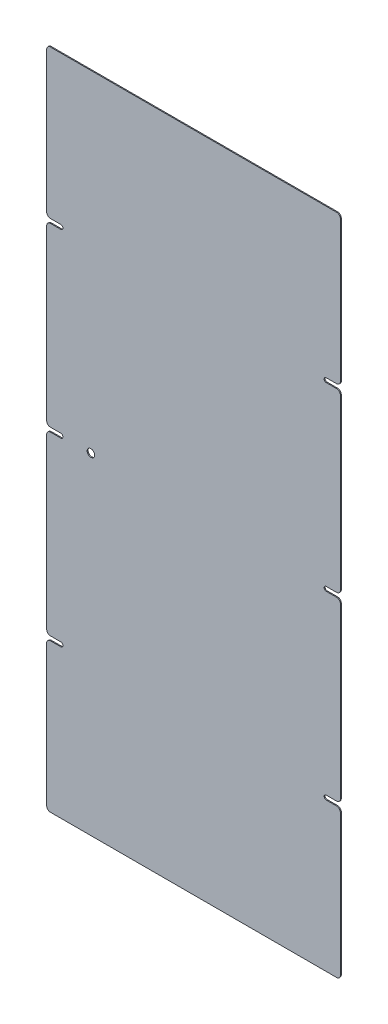
from build123d import *

# Parameters (mm, degrees)
SKETCH1_W           = 495.3
SKETCH1_H           = 1117.6
SKETCH1_R           = 3.5687
BOSS_EXTRUDE1_DEPTH = 1.5875
CUT_EXTRUDE1_DEPTH  = 612.220486123
FILLET1_R           = 6.35
SKETCH3_R           = 6.35
CUT_EXTRUDE2_DEPTH  = 612.220486123


with BuildPart() as part:
    # Sketch1 → Boss-Extrude1 (new body)
    with BuildSketch(Plane.XY):
        Rectangle(SKETCH1_W, SKETCH1_H)
        with Locations((223.8375, 304.8)):
            Circle(SKETCH1_R, mode=Mode.SUBTRACT)
        with Locations((223.8375, -304.8)):
            Circle(SKETCH1_R, mode=Mode.SUBTRACT)
        with Locations((223.8375, 0)):
            Circle(SKETCH1_R, mode=Mode.SUBTRACT)
        with Locations((-223.8375, -304.8)):
            Circle(SKETCH1_R, mode=Mode.SUBTRACT)
        with Locations((-223.8375, 0)):
            Circle(SKETCH1_R, mode=Mode.SUBTRACT)
        with Locations((-223.8375, 304.8)):
            Circle(SKETCH1_R, mode=Mode.SUBTRACT)
    extrude(amount=BOSS_EXTRUDE1_DEPTH)

    # Sketch2 → Cut-Extrude1 (cut, through all)
    with BuildSketch(Plane.XY.offset(1.5875)):
        with BuildLine():
            Line((-223.8375, 301.2313), (-276.915511323, 301.2313))
            ThreePointArc((-276.915511323, 301.2313), (-280.484211323, 304.8), (-276.915511323, 308.3687))
            Line((-276.915511323, 308.3687), (-223.8375, 308.3687))
            ThreePointArc((-223.8375, 308.3687), (-220.2688, 304.8), (-223.8375, 301.2313))
        make_face()
        with BuildLine():
            Line((-223.8375, -3.5687), (-306.276059446, -3.5687))
            ThreePointArc((-306.276059446, -3.5687), (-309.844759446, 0), (-306.276059446, 3.5687))
            Line((-306.276059446, 3.5687), (-223.8375, 3.5687))
            ThreePointArc((-223.8375, 3.5687), (-220.2688, 0), (-223.8375, -3.5687))
        make_face()
        with BuildLine():
            Line((304.87504686, 301.2313), (223.8375, 301.2313))
            ThreePointArc((223.8375, 301.2313), (220.2688, 304.8), (223.8375, 308.3687))
            Line((223.8375, 308.3687), (304.87504686, 308.3687))
            ThreePointArc((304.87504686, 308.3687), (308.44374686, 304.8), (304.87504686, 301.2313))
        make_face()
        with BuildLine():
            Line((299.858272086, -3.5687), (223.8375, -3.5687))
            ThreePointArc((223.8375, -3.5687), (220.2688, 0), (223.8375, 3.5687))
            Line((223.8375, 3.5687), (299.858272086, 3.5687))
            ThreePointArc((299.858272086, 3.5687), (303.426972086, 0), (299.858272086, -3.5687))
        make_face()
        with BuildLine():
            Line((308.359897186, -308.3687), (223.8375, -308.3687))
            ThreePointArc((223.8375, -308.3687), (220.2688, -304.8), (223.8375, -301.2313))
            Line((223.8375, -301.2313), (308.359897186, -301.2313))
            ThreePointArc((308.359897186, -301.2313), (311.928597186, -304.8), (308.359897186, -308.3687))
        make_face()
        with BuildLine():
            Line((-223.8375, -308.3687), (-314.955998192, -308.3687))
            ThreePointArc((-314.955998192, -308.3687), (-318.524698192, -304.8), (-314.955998192, -301.2313))
            Line((-314.955998192, -301.2313), (-223.8375, -301.2313))
            ThreePointArc((-223.8375, -301.2313), (-220.2688, -304.8), (-223.8375, -308.3687))
        make_face()
    extrude(amount=-CUT_EXTRUDE1_DEPTH, mode=Mode.SUBTRACT)

    # Fillet1
    fillet1_edges = [part.edges().sort_by_distance(p)[0] for p in [
        (247.65, -558.8, 0.79375),
        (-247.65, 558.8, 0.79375),
        (247.65, 558.8, 0.79375),
        (-247.65, -558.8, 0.79375),
        (-247.65, -301.2313, 0.79375),
        (-247.65, -3.5687, 0.79375),
        (-247.65, 3.5687, 0.79375),
        (-247.65, 301.2313, 0.79375),
        (-247.65, 308.3687, 0.79375),
        (247.65, 308.3687, 0.79375),
        (247.65, 301.2313, 0.79375),
        (247.65, 3.5687, 0.79375),
        (247.65, -3.5687, 0.79375),
        (247.65, -301.2313, 0.79375),
        (247.65, -308.3687, 0.79375),
        (-247.65, -308.3687, 0.79375),
    ]]
    fillet(fillet1_edges, radius=FILLET1_R)

    # Sketch3 → Cut-Extrude2 (cut, through all)
    with BuildSketch(Plane(origin=(0, 0, 0), x_dir=(-1, 0, 0), z_dir=(0, 0, -1))):
        with Locations((173.0375, 0)):
            Circle(SKETCH3_R)
    extrude(amount=-CUT_EXTRUDE2_DEPTH, mode=Mode.SUBTRACT)


solid = part.part
